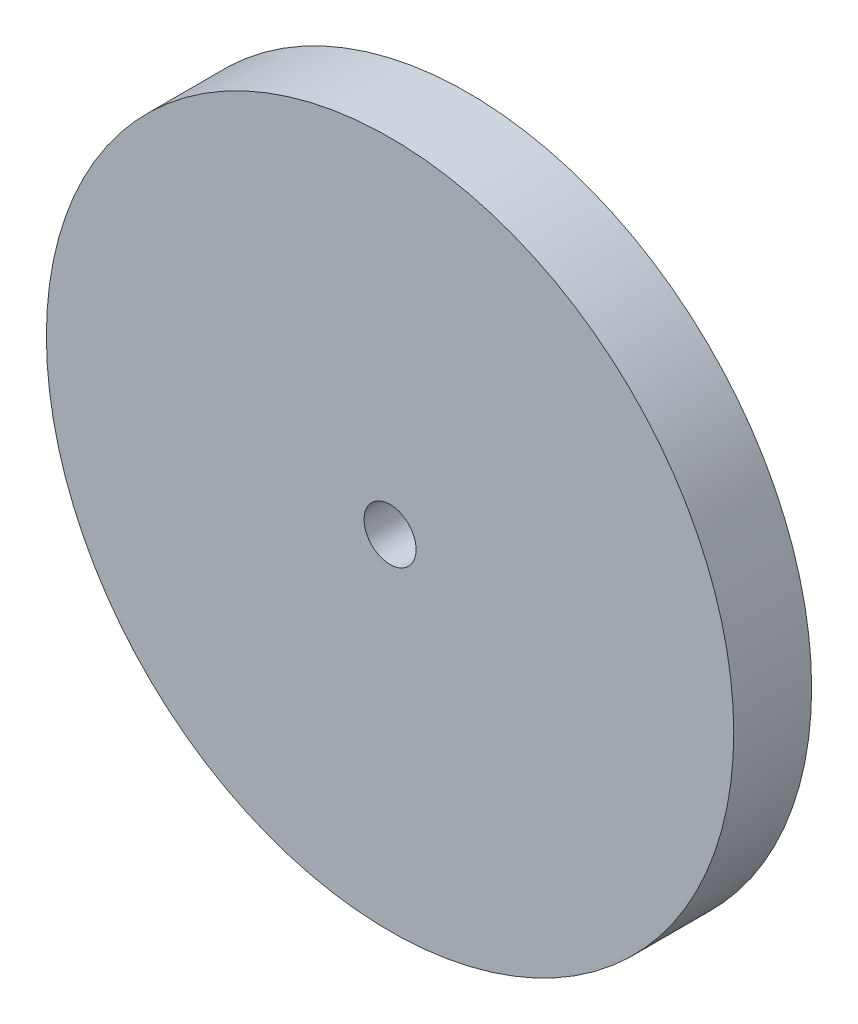
from build123d import *

# Parameters (mm, degrees)
SKETCH1_R           = 24.66826923
SKETCH1_R_2         = 1.8669
BOSS_EXTRUDE1_DEPTH = 5.588


with BuildPart() as part:
    # Sketch1 → Boss-Extrude1 (new body)
    with BuildSketch(Plane.XY):
        Circle(SKETCH1_R)
        Circle(SKETCH1_R_2, mode=Mode.SUBTRACT)
    extrude(amount=BOSS_EXTRUDE1_DEPTH)


solid = part.part
